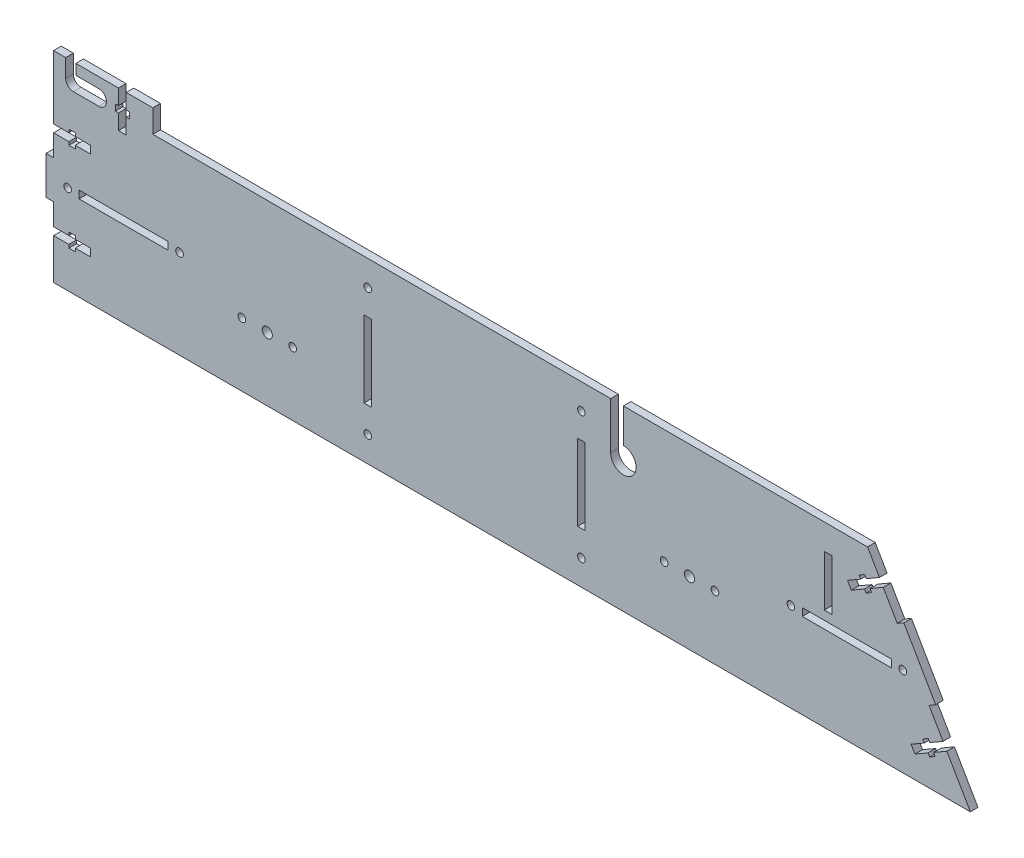
from build123d import *

# Parameters (mm, degrees)
SKETCH_1_R             = 2
SKETCH_1_R_2           = 1.5
EXTRUDE_1_DEPTH        = 3
SKETCH_2_W             = 19
SKETCH_2_H             = 3
EXTRUDE_2_DEPTH        = 3
PATTERN_LINEAR_1_COUNT = 9
PATTERN_LINEAR_1_PITCH = 28
SKETCH_3_W             = 3
SKETCH_3_H             = 30
CUT_EXTRUDE_1_DEPTH    = 3
SKETCH_4_W             = 35
SKETCH_4_H             = 3
CUT_EXTRUDE_2_DEPTH    = 3
SKETCH_5_R             = 1.5
CUT_EXTRUDE_3_DEPTH    = 3
CUT_EXTRUDE_4_DEPTH    = 3
CUT_EXTRUDE_5_DEPTH    = 3
SKETCH_8_W             = 39
SKETCH_8_H             = 3
EXTRUDE_3_DEPTH        = 9
SKETCH_11_W            = 3
SKETCH_11_H            = 25
EXTRUDE_5_DEPTH        = 3
SKETCH_12_W            = 3
SKETCH_12_H            = 15
EXTRUDE_6_DEPTH        = 3
SKETCH_13_W            = 243
SKETCH_13_H            = 3
CUT_EXTRUDE_7_DEPTH    = 3
SKETCH_14_W            = 3
SKETCH_14_H            = 20
CUT_EXTRUDE_8_DEPTH    = 10
CUT_EXTRUDE_9_DEPTH    = 3
CUT_EXTRUDE_10_DEPTH   = 10
CUT_EXTRUDE_11_DEPTH   = 10


with BuildPart() as part:
    # Эскиз1 → Бобышка-Вытянуть1 (new body)
    with BuildSketch(Plane.XY):
        Polygon((320, 70), (360.414518843, 0), (0, 0), (0, 70), align=None)
        with Locations((84, 25)):
            Circle(SKETCH_1_R, mode=Mode.SUBTRACT)
        with Locations((250, 25)):
            Circle(SKETCH_1_R, mode=Mode.SUBTRACT)
        with Locations((94, 25)):
            Circle(SKETCH_1_R_2, mode=Mode.SUBTRACT)
        with Locations((74, 25)):
            Circle(SKETCH_1_R_2, mode=Mode.SUBTRACT)
        with Locations((240, 25)):
            Circle(SKETCH_1_R_2, mode=Mode.SUBTRACT)
        with Locations((260, 25)):
            Circle(SKETCH_1_R_2, mode=Mode.SUBTRACT)
    extrude(amount=EXTRUDE_1_DEPTH)

    # Эскиз2 → Бобышка-Вытянуть2 (add)
    with BuildSketch(Plane(origin=(0, 70, 0), x_dir=(1, 0, 0), z_dir=(0, 1, 0))):
        with Locations((291.5, -1.5)):
            Rectangle(SKETCH_2_W, SKETCH_2_H)
    extrude_2 = extrude(amount=EXTRUDE_2_DEPTH)

    # Линейный массив1: Бобышка-Вытянуть2 ×9
    with Locations(*[(-i * PATTERN_LINEAR_1_PITCH, 0, 0) for i in range(1, PATTERN_LINEAR_1_COUNT)]):
        add(extrude_2)

    # Эскиз3 → Вырез-Вытянуть1 (cut)
    with BuildSketch(Plane.XY.offset(3)):
        with Locations((207.5, 35)):
            Rectangle(SKETCH_3_W, SKETCH_3_H)
        with Locations((123.5, 35)):
            Rectangle(SKETCH_3_W, SKETCH_3_H)
    extrude(amount=-CUT_EXTRUDE_1_DEPTH, mode=Mode.SUBTRACT)

    # Эскиз4 → Вырез-Вытянуть2 (cut)
    with BuildSketch(Plane.XY.offset(3)):
        with Locations((311.841234018, 35)):
            Rectangle(SKETCH_4_W, SKETCH_4_H)
        with Locations((27.5, 35)):
            Rectangle(SKETCH_4_W, SKETCH_4_H)
    extrude(amount=-CUT_EXTRUDE_2_DEPTH, mode=Mode.SUBTRACT)

    # Эскиз5 → Вырез-Вытянуть3 (cut)
    with BuildSketch(Plane.XY.offset(3)):
        with Locations((5.5, 35)):
            Circle(SKETCH_5_R)
        with Locations((49.5, 35)):
            Circle(SKETCH_5_R)
        with Locations((123.5, 60)):
            Circle(SKETCH_5_R)
        with Locations((123.5, 10)):
            Circle(SKETCH_5_R)
        with Locations((207.5, 60)):
            Circle(SKETCH_5_R)
        with Locations((207.5, 10)):
            Circle(SKETCH_5_R)
        with Locations((289.841234018, 35)):
            Circle(SKETCH_5_R)
        with Locations((333.841234018, 35)):
            Circle(SKETCH_5_R)
    extrude(amount=-CUT_EXTRUDE_3_DEPTH, mode=Mode.SUBTRACT)

    # Эскиз6 → Вырез-Вытянуть4 (cut)
    with BuildSketch(Plane.XY.offset(3)):
        Polygon((0, 54), (6, 54), (6, 55.25), (8.5, 55.25), (8.5, 54), (14.5, 54), (14.5, 51), (8.5, 51), (8.5, 49.75), (6, 49.75), (6, 51), (0, 51), align=None)
        Polygon((0, 19), (6, 19), (6, 20.25), (8.5, 20.25), (8.5, 19), (14.5, 19), (14.5, 16), (8.5, 16), (8.5, 14.75), (6, 14.75), (6, 16), (0, 16), align=None)
    extrude(amount=-CUT_EXTRUDE_4_DEPTH, mode=Mode.SUBTRACT)

    # Эскиз7 → Вырез-Вытянуть5 (cut)
    with BuildSketch(Plane.XY.offset(3)):
        Polygon((324.664518843, 61.920816371), (319.468366421, 58.920816371), (318.843366421, 60.003348125), (316.678302911, 58.753348125), (317.303302911, 57.670816371), (312.107150488, 54.670816371), (313.607150488, 52.072740159), (318.803302911, 55.072740159), (319.428302911, 53.990208405), (321.593366421, 55.240208405), (320.968366421, 56.322740159), (326.164518843, 59.322740159), align=None)
        Polygon((349.664518843, 18.619546181), (344.468366421, 15.619546181), (343.843366421, 16.702077936), (341.678302911, 15.452077936), (342.303302911, 14.369546181), (337.107150488, 11.369546181), (338.607150488, 8.77146997), (343.803302911, 11.77146997), (344.428302911, 10.688938215), (346.593366421, 11.938938215), (345.968366421, 13.02146997), (351.164518843, 16.02146997), align=None)
    extrude(amount=-CUT_EXTRUDE_5_DEPTH, mode=Mode.SUBTRACT)

    # Эскиз8 → Бобышка-Вытянуть3 (add)
    with BuildSketch(Plane(origin=(0, 70, 0), x_dir=(1, 0, 0), z_dir=(0, 1, 0))):
        with Locations((19.5, -1.5)):
            Rectangle(SKETCH_8_W, SKETCH_8_H)
    extrude(amount=EXTRUDE_3_DEPTH)

    # Эскиз11 → Бобышка-Вытянуть5 (add)
    with BuildSketch(Plane(origin=(270.310889132, 156.064064606, 0), x_dir=(0, 0, -1), z_dir=(0.8660254037844416, 0.4999999999999949, 0))):
        with Locations((-1.5, -135.207259422)):
            Rectangle(SKETCH_11_W, SKETCH_11_H)
    extrude(amount=EXTRUDE_5_DEPTH)

    # Эскиз12 → Бобышка-Вытянуть6 (add)
    with BuildSketch(Plane.ZY):
        with Locations((1.5, 35)):
            Rectangle(SKETCH_12_W, SKETCH_12_H)
    extrude(amount=EXTRUDE_6_DEPTH)

    # Эскиз13 → Вырез-Вытянуть7 (cut)
    with BuildSketch(Plane.XY.offset(3)):
        with Locations((179.5, 71.5)):
            Rectangle(SKETCH_13_W, SKETCH_13_H)
    extrude(amount=-CUT_EXTRUDE_7_DEPTH, mode=Mode.SUBTRACT)

    # Эскиз14 → Вырез-Вытянуть8 (cut)
    with BuildSketch(Plane.XY.offset(3)):
        with Locations((304.5, 50)):
            Rectangle(SKETCH_14_W, SKETCH_14_H)
    extrude(amount=-CUT_EXTRUDE_8_DEPTH, mode=Mode.SUBTRACT)

    # Эскиз15 → Вырез-Вытянуть9 (cut)
    with BuildSketch(Plane.XY.offset(3)):
        Polygon((25.5, 79), (25.5, 73), (24.25, 73), (24.25, 70.5), (25.5, 70.5), (25.5, 64.5), (28.5, 64.5), (28.5, 70.5), (29.75, 70.5), (29.75, 73), (28.5, 73), (28.5, 79), align=None)
    extrude(amount=-CUT_EXTRUDE_9_DEPTH, mode=Mode.SUBTRACT)

    # Эскиз16 → Вырез-Вытянуть10 (cut)
    with BuildSketch(Plane.XY.offset(3)):
        with BuildLine():
            Line((8.75, 74.898901738), (17.75, 74.898901738))
            ThreePointArc((17.75, 74.898901738), (20.75, 71.898901738), (17.75, 68.898901738))
            Line((17.75, 68.898901738), (7.75, 68.898901738))
            ThreePointArc((7.75, 68.898901738), (5.628679656, 69.777581394), (4.75, 71.898901738))
            Line((4.75, 71.898901738), (4.75, 79))
            Line((4.75, 79), (8.75, 79))
            Line((8.75, 79), (8.75, 74.898901738))
        make_face()
    extrude(amount=-CUT_EXTRUDE_10_DEPTH, mode=Mode.SUBTRACT)

    # Эскиз17 → Вырез-Вытянуть11 (cut)
    with BuildSketch(Plane.XY.offset(3)):
        with BuildLine():
            Line((219, 51.5), (219, 70))
            Line((219, 70), (224, 70))
            Line((224, 70), (224, 56.5))
            ThreePointArc((224, 56.5), (227.535533906, 47.964466094), (219, 51.5))
        make_face()
    extrude(amount=-CUT_EXTRUDE_11_DEPTH, mode=Mode.SUBTRACT)


solid = part.part
